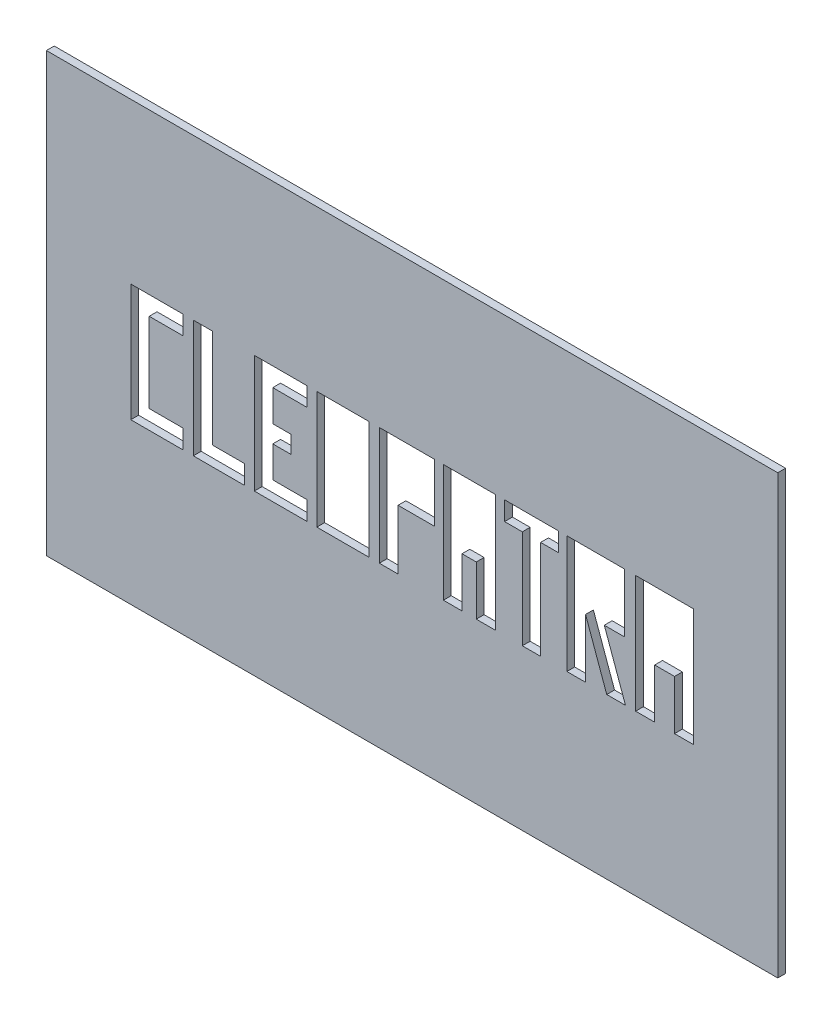
from build123d import *

# Parameters (mm, degrees)
SKETCH1_W           = 297.18
SKETCH1_H           = 177.8
BOSS_EXTRUDE1_DEPTH = 3.175
SKETCH3_W           = 13.69262242
SKETCH3_H           = 7.623435988
SKETCH3_W_2         = 7.48484453
SKETCH3_H_2         = 16.262538767
SKETCH3_H_3         = 16.21355287
SKETCH3_H_4         = 7.672421885
SKETCH3_W_3         = 7.714624958
SKETCH3_H_5         = 23.885974755
SKETCH3_W_4         = 13.165983096
SKETCH3_W_5         = 7.502078631
SKETCH3_H_6         = 3.540074356
SKETCH3_W_6         = 7.385030665
SKETCH3_H_7         = 12.673478514
SKETCH3_W_7         = 13.868168861
SKETCH3_H_8         = 12.722464411
SKETCH3_W_8         = 7.610546603
SKETCH3_H_9         = 8.377243284
SKETCH3_H_10        = 7.522942085
SKETCH3_W_9         = 7.199942392
SKETCH3_W_10        = 7.545958675
SKETCH3_H_11        = 0.313367501
SKETCH3_W_11        = 6.151941086
SKETCH3_W_12        = 7.563125845
SKETCH3_W_13        = 5.793032563
SKETCH3_W_14        = 7.724043416
SKETCH3_H_12        = 12.138714327
SKETCH3_H_13        = 20.136219216
SKETCH3_H_14        = 4.074838543
SKETCH3_H_15        = 3.749755539
SKETCH3_W_15        = 7.197404092
SKETCH3_W_16        = 7.446094885
SKETCH3_W_17        = 7.592383586
SKETCH3_W_18        = 8.426229181
SKETCH3_W_19        = 7.372950534
SKETCH3_H_16        = 7.836309586
SKETCH3_W_20        = 7.738672287
SKETCH3_W_21        = 8.057581655
SKETCH3_W_22        = 7.668237515
CUT_EXTRUDE4_DEPTH  = 3.175


with BuildPart() as part:
    # Sketch1 → Boss-Extrude1 (new body)
    with BuildSketch(Plane.XY):
        Rectangle(SKETCH1_W, SKETCH1_H)
    extrude(amount=BOSS_EXTRUDE1_DEPTH)

    # Sketch3 → Cut-Extrude4 (cut)
    with BuildSketch(Plane.XY.offset(3.175)):
        with Locations((-99.96884426, 20.074256761)):
            Rectangle(SKETCH3_W, SKETCH3_H)
        with Locations((-110.557577735, 20.074256761)):
            Rectangle(SKETCH3_W_2, SKETCH3_H)
        with Locations((-110.557577735, 8.131269384)):
            Rectangle(SKETCH3_W_2, SKETCH3_H_2)
        with Locations((-110.557577735, -8.106776435)):
            Rectangle(SKETCH3_W_2, SKETCH3_H_3)
        with Locations((-110.557577735, -20.049763813)):
            Rectangle(SKETCH3_W_2, SKETCH3_H_4)
        with Locations((-99.96884426, -20.049763813)):
            Rectangle(SKETCH3_W, SKETCH3_H_4)
        with Locations((-85.042687521, 11.942987378)):
            Rectangle(SKETCH3_W_3, SKETCH3_H_5)
        with Locations((-85.042687521, -8.106776435)):
            Rectangle(SKETCH3_W_3, SKETCH3_H_3)
        with Locations((-74.602383494, -20.049763813)):
            Rectangle(SKETCH3_W_4, SKETCH3_H_4)
        with Locations((-85.042687521, -20.049763813)):
            Rectangle(SKETCH3_W_3, SKETCH3_H_4)
        with Locations((-60.359912579, 1.770037178)):
            Rectangle(SKETCH3_W_5, SKETCH3_H_6)
        with Locations((-52.916357931, 1.770037178)):
            Rectangle(SKETCH3_W_6, SKETCH3_H_6)
        with Locations((-52.916357931, -1.770037178)):
            Rectangle(SKETCH3_W_6, SKETCH3_H_6)
        with Locations((-60.359912579, -1.770037178)):
            Rectangle(SKETCH3_W_5, SKETCH3_H_6)
        with Locations((-60.359912579, -9.876813613)):
            Rectangle(SKETCH3_W_5, SKETCH3_H_7)
        with Locations((-60.359912579, -20.049763813)):
            Rectangle(SKETCH3_W_5, SKETCH3_H_4)
        with Locations((-49.674788833, -20.049763813)):
            Rectangle(SKETCH3_W_7, SKETCH3_H_4)
        with Locations((-60.359912579, 9.901306562)):
            Rectangle(SKETCH3_W_5, SKETCH3_H_8)
        with Locations((-60.359912579, 20.074256761)):
            Rectangle(SKETCH3_W_5, SKETCH3_H)
        with Locations((-49.674788833, 20.074256761)):
            Rectangle(SKETCH3_W_7, SKETCH3_H)
        Polygon((-25.010513832, 0), (-17.462016857, 0), (-17.462016857, 23.885974755), (-38.710951894, 23.885974755), (-38.710951894, 0), (-31.162454918, 0), (-31.162454918, 16.21355287), (-25.010513832, 16.21355287), align=None)
        Polygon((-17.462016857, -23.885974755), (-17.462016857, 0), (-25.010513832, 0), (-25.010513832, -16.21355287), (-31.162454918, -16.21355287), (-31.162454918, 0), (-38.710951894, 0), (-38.710951894, -23.885974755), align=None)
        with Locations((-9.505678593, -11.942987378)):
            Rectangle(SKETCH3_W_8, SKETCH3_H_5)
        with Locations((-9.505678593, 20.049763813)):
            Rectangle(SKETCH3_W_8, SKETCH3_H_4)
        with Locations((-9.505678593, 12.024931228)):
            Rectangle(SKETCH3_W_8, SKETCH3_H_9)
        with Locations((-9.505678593, 4.074838544)):
            Rectangle(SKETCH3_W_8, SKETCH3_H_10)
        with Locations((-2.100434095, 4.074838544)):
            Rectangle(SKETCH3_W_9, SKETCH3_H_10)
        with Locations((5.272516439, 4.074838544)):
            Rectangle(SKETCH3_W_10, SKETCH3_H_10)
        with Locations((5.272516439, 12.024931228)):
            Rectangle(SKETCH3_W_10, SKETCH3_H_9)
        with Locations((5.272516439, 20.049763813)):
            Rectangle(SKETCH3_W_10, SKETCH3_H_4)
        with Locations((-2.100434095, 20.049763813)):
            Rectangle(SKETCH3_W_9, SKETCH3_H_4)
        with Locations((-9.505678593, 0.15668375)):
            Rectangle(SKETCH3_W_8, SKETCH3_H_11)
        with Locations((-28.086484375, 8.106776435)):
            Rectangle(SKETCH3_W_11, SKETCH3_H_3)
        with Locations((-28.086484375, -8.106776435)):
            Rectangle(SKETCH3_W_11, SKETCH3_H_3)
        with Locations((-2.100434095, 12.024931228)):
            Rectangle(SKETCH3_W_9, SKETCH3_H_9)
        with Locations((16.498905095, 20.049763813)):
            Rectangle(SKETCH3_W_12, SKETCH3_H_4)
        with Locations((23.176984299, 20.049763813)):
            Rectangle(SKETCH3_W_13, SKETCH3_H_4)
        with Locations((29.935522289, 20.049763813)):
            Rectangle(SKETCH3_W_14, SKETCH3_H_4)
        with Locations((29.935522289, 10.144195706)):
            Rectangle(SKETCH3_W_14, SKETCH3_H_12)
        with Locations((16.498905095, 10.144195706)):
            Rectangle(SKETCH3_W_12, SKETCH3_H_12)
        with Locations((16.498905095, -13.817865147)):
            Rectangle(SKETCH3_W_12, SKETCH3_H_13)
        with Locations((29.935522289, -13.817865147)):
            Rectangle(SKETCH3_W_14, SKETCH3_H_13)
        with Locations((23.176984299, 2.037419272)):
            Rectangle(SKETCH3_W_13, SKETCH3_H_14)
        with Locations((23.176984299, -1.87487777)):
            Rectangle(SKETCH3_W_13, SKETCH3_H_15)
        with Locations((16.498905095, -1.87487777)):
            Rectangle(SKETCH3_W_12, SKETCH3_H_15)
        with Locations((16.498905095, 2.037419272)):
            Rectangle(SKETCH3_W_12, SKETCH3_H_14)
        with Locations((29.935522289, 2.037419272)):
            Rectangle(SKETCH3_W_14, SKETCH3_H_14)
        with Locations((29.935522289, -1.87487777)):
            Rectangle(SKETCH3_W_14, SKETCH3_H_15)
        with Locations((23.176984299, 10.144195706)):
            Rectangle(SKETCH3_W_13, SKETCH3_H_12)
        with Locations((41.185123401, 20.049763813)):
            Rectangle(SKETCH3_W_15, SKETCH3_H_4)
        with Locations((48.50687289, 20.049763813)):
            Rectangle(SKETCH3_W_16, SKETCH3_H_4)
        with Locations((55.828622378, 20.049763813)):
            Rectangle(SKETCH3_W_15, SKETCH3_H_4)
        with Locations((48.50687289, 8.106776435)):
            Rectangle(SKETCH3_W_16, SKETCH3_H_3)
        with Locations((66.690558432, 20.049763813)):
            Rectangle(SKETCH3_W_17, SKETCH3_H_4)
        with Locations((74.699864816, 20.049763813)):
            Rectangle(SKETCH3_W_18, SKETCH3_H_4)
        with Locations((48.50687289, -11.942987378)):
            Rectangle(SKETCH3_W_16, SKETCH3_H_5)
        with Locations((82.599454673, 20.049763813)):
            Rectangle(SKETCH3_W_19, SKETCH3_H_4)
        with Locations((74.699864816, 12.024931228)):
            Rectangle(SKETCH3_W_18, SKETCH3_H_9)
        with Locations((66.690558432, 12.024931228)):
            Rectangle(SKETCH3_W_17, SKETCH3_H_9)
        with Locations((82.599454673, 12.024931228)):
            Rectangle(SKETCH3_W_19, SKETCH3_H_9)
        Polygon((70.486750225, 7.836309586), (70.486750225, 0), (78.106750225, 0), (86.28592994, 0), (86.28592994, 7.836309586), (78.912979406, 7.836309586), align=None)
        Polygon((78.106750225, 0), (70.486750225, 0), (79.088525848, -23.885974755), (86.708525848, -23.885974755), align=None)
        with Locations((66.690558432, -11.942987378)):
            Rectangle(SKETCH3_W_17, SKETCH3_H_5)
        with Locations((66.690558432, 3.918154793)):
            Rectangle(SKETCH3_W_17, SKETCH3_H_16)
        with Locations((94.704844686, 20.049763813)):
            Rectangle(SKETCH3_W_20, SKETCH3_H_4)
        with Locations((102.602971658, 20.049763813)):
            Rectangle(SKETCH3_W_21, SKETCH3_H_4)
        with Locations((94.704844686, 10.144195706)):
            Rectangle(SKETCH3_W_20, SKETCH3_H_12)
        with Locations((110.465881243, 20.049763813)):
            Rectangle(SKETCH3_W_22, SKETCH3_H_4)
        with Locations((110.465881243, 10.144195706)):
            Rectangle(SKETCH3_W_22, SKETCH3_H_12)
        with Locations((110.465881243, -13.817865147)):
            Rectangle(SKETCH3_W_22, SKETCH3_H_13)
        with Locations((102.602971658, 10.144195706)):
            Rectangle(SKETCH3_W_21, SKETCH3_H_12)
        with Locations((94.704844686, -1.87487777)):
            Rectangle(SKETCH3_W_20, SKETCH3_H_15)
        with Locations((94.704844686, 2.037419272)):
            Rectangle(SKETCH3_W_20, SKETCH3_H_14)
        with Locations((110.465881243, 2.037419272)):
            Rectangle(SKETCH3_W_22, SKETCH3_H_14)
        with Locations((102.602971658, -1.87487777)):
            Rectangle(SKETCH3_W_21, SKETCH3_H_15)
        with Locations((94.704844686, -13.817865147)):
            Rectangle(SKETCH3_W_20, SKETCH3_H_13)
        with Locations((102.602971658, 2.037419272)):
            Rectangle(SKETCH3_W_21, SKETCH3_H_14)
        with Locations((110.465881243, -1.87487777)):
            Rectangle(SKETCH3_W_22, SKETCH3_H_15)
    extrude(amount=-CUT_EXTRUDE4_DEPTH, mode=Mode.SUBTRACT)


solid = part.part
